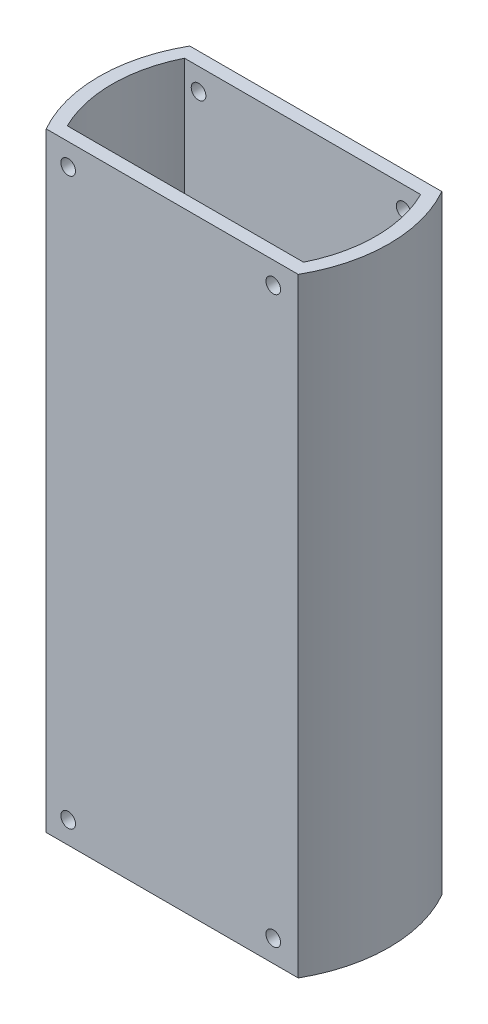
from build123d import *

# Parameters (mm, degrees)
BOSS_EXTRUDE1_DEPTH = 208
SKETCH3_R           = 2.5
CUT_EXTRUDE1_DEPTH  = 60


with BuildPart() as part:
    # Sketch2 → Boss-Extrude1 (new body)
    with BuildSketch(Plane(origin=(0, 0, 0), x_dir=(1, 0, 0), z_dir=(0, 1, 0))):
        with BuildLine():
            Line((-45.279686395, -20), (-40.311288741, -20))
            ThreePointArc((-40.311288741, -20), (-45, 0), (-40.311288741, 20))
            Line((-40.311288741, 20), (-45.279686395, 20))
            ThreePointArc((-45.279686395, 20), (-49.5, 0), (-45.279686395, -20))
        make_face()
        with BuildLine():
            ThreePointArc((45, 0), (43.812144397, -10.271124735), (40.311288741, -20))
            Line((40.311288741, -20), (45.279686395, -20))
            ThreePointArc((45.279686395, -20), (48.433430998, -10.22021339), (49.5, 0))
            ThreePointArc((49.5, 0), (48.433430998, 10.22021339), (45.279686395, 20))
            Line((45.279686395, 20), (40.311288741, 20))
            ThreePointArc((40.311288741, 20), (43.812144397, 10.271124735), (45, 0))
        make_face()
        with BuildLine():
            ThreePointArc((-37.7458607, -24.5), (-39.093377249, -22.286943605), (-40.311288741, -20))
            Line((-40.311288741, -20), (-45.279686395, -20))
            ThreePointArc((-45.279686395, -20), (-44.202957773, -22.278880674), (-43.011626335, -24.5))
            Line((-43.011626335, -24.5), (-37.7458607, -24.5))
        make_face()
        with BuildLine():
            Line((45.279686395, -20), (40.311288741, -20))
            ThreePointArc((40.311288741, -20), (39.093377249, -22.286943605), (37.7458607, -24.5))
            Line((37.7458607, -24.5), (43.011626335, -24.5))
            ThreePointArc((43.011626335, -24.5), (44.202957773, -22.278880674), (45.279686395, -20))
        make_face()
        with BuildLine():
            Line((40.311288741, -20), (0, -20))
            Line((0, -20), (-40.311288741, -20))
            ThreePointArc((-40.311288741, -20), (-39.093377249, -22.286943605), (-37.7458607, -24.5))
            Line((-37.7458607, -24.5), (37.7458607, -24.5))
            ThreePointArc((37.7458607, -24.5), (39.093377249, -22.286943605), (40.311288741, -20))
        make_face()
        with BuildLine():
            Line((-45.279686395, 20), (-40.311288741, 20))
            ThreePointArc((-40.311288741, 20), (-39.093377249, 22.286943605), (-37.7458607, 24.5))
            Line((-37.7458607, 24.5), (-43.011626335, 24.5))
            ThreePointArc((-43.011626335, 24.5), (-44.202957773, 22.278880674), (-45.279686395, 20))
        make_face()
        with BuildLine():
            ThreePointArc((37.7458607, 24.5), (39.093377249, 22.286943605), (40.311288741, 20))
            Line((40.311288741, 20), (45.279686395, 20))
            ThreePointArc((45.279686395, 20), (44.202957773, 22.278880674), (43.011626335, 24.5))
            Line((43.011626335, 24.5), (37.7458607, 24.5))
        make_face()
        with BuildLine():
            Line((-40.311288741, 20), (0, 20))
            Line((0, 20), (40.311288741, 20))
            ThreePointArc((40.311288741, 20), (39.093377249, 22.286943605), (37.7458607, 24.5))
            Line((37.7458607, 24.5), (-37.7458607, 24.5))
            ThreePointArc((-37.7458607, 24.5), (-39.093377249, 22.286943605), (-40.311288741, 20))
        make_face()
    extrude(amount=BOSS_EXTRUDE1_DEPTH)

    # Sketch3 → Cut-Extrude1 (cut)
    with BuildSketch(Plane.XY.offset(24.5)):
        with Locations((-35.511626335, 200.5)):
            Circle(SKETCH3_R)
        with Locations((34.488373665, 200.5)):
            Circle(SKETCH3_R)
        with Locations((34.488373665, 7.5)):
            Circle(SKETCH3_R)
        with Locations((-35.511626335, 7.5)):
            Circle(SKETCH3_R)
    extrude(amount=-CUT_EXTRUDE1_DEPTH, mode=Mode.SUBTRACT)


solid = part.part
